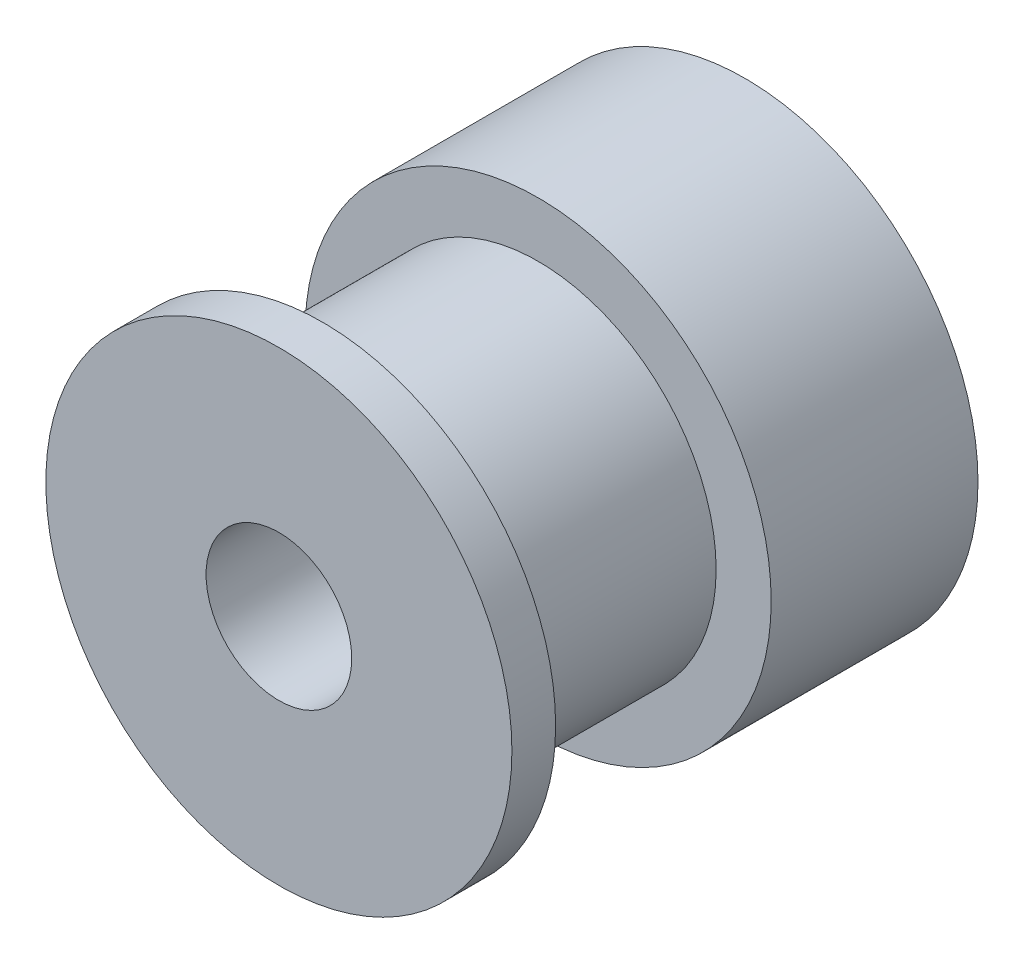
from build123d import *

# Parameters (mm, degrees)
SKETCH1_R           = 8
BOSS_EXTRUDE1_DEPTH = 7.1
SKETCH2_R           = 6.11
BOSS_EXTRUDE2_DEPTH = 7.4
SKETCH3_R           = 8
BOSS_EXTRUDE3_DEPTH = 1.5
SKETCH4_R           = 2.5
CUT_EXTRUDE1_DEPTH  = 20.595917942


with BuildPart() as part:
    # Sketch1 → Boss-Extrude1 (new body)
    with BuildSketch(Plane.XY):
        Circle(SKETCH1_R)
    extrude(amount=BOSS_EXTRUDE1_DEPTH)

    # Sketch2 → Boss-Extrude2 (add)
    with BuildSketch(Plane.XY.offset(7.1)):
        Circle(SKETCH2_R)
    extrude(amount=BOSS_EXTRUDE2_DEPTH)

    # Sketch3 → Boss-Extrude3 (add)
    with BuildSketch(Plane.XY.offset(14.5)):
        Circle(SKETCH3_R)
    extrude(amount=BOSS_EXTRUDE3_DEPTH)

    # Sketch4 → Cut-Extrude1 (cut, through all)
    with BuildSketch(Plane.XY.offset(16)):
        Circle(SKETCH4_R)
    extrude(amount=-CUT_EXTRUDE1_DEPTH, mode=Mode.SUBTRACT)


solid = part.part
